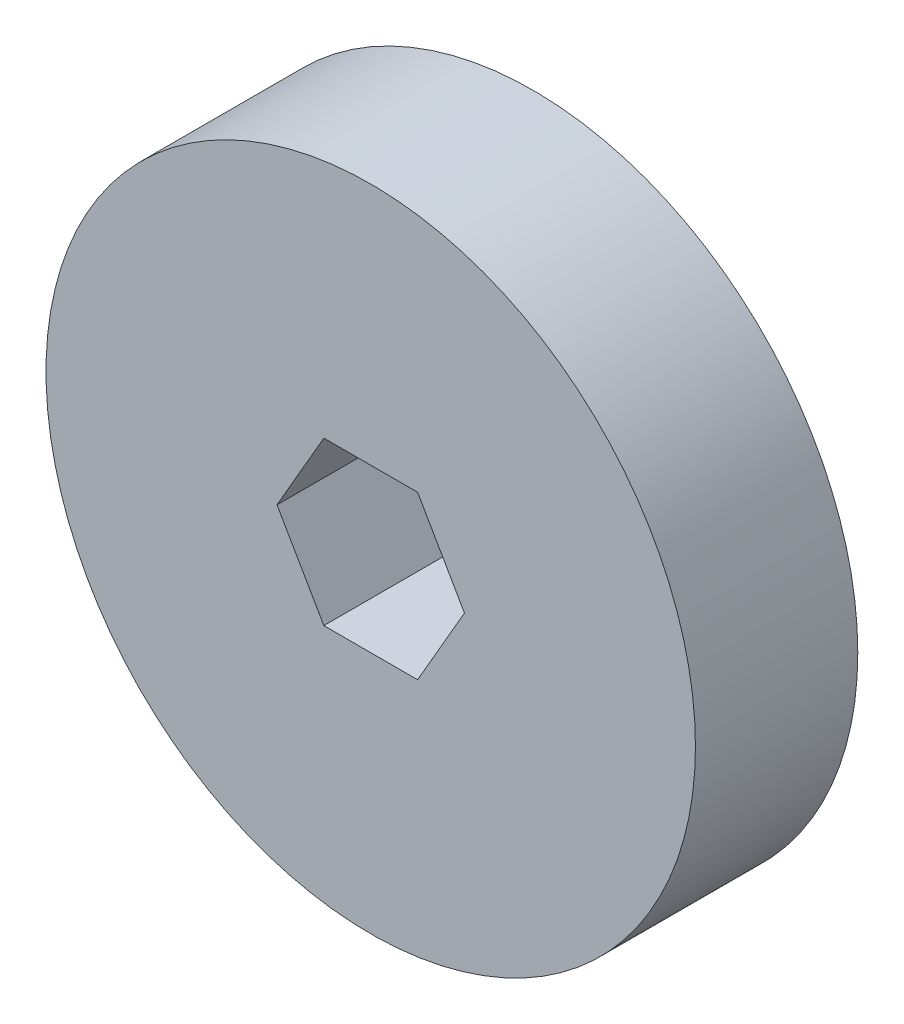
from build123d import *

# Parameters (mm, degrees)
SKETCH1_R               = 25.4
BOSS_EXTRUDE1_DEPTH     = 12.7
CUT_EXTRUDE1_DEPTH      = 39.1
CUT_EXTRUDE1_DEPTH_BACK = 39.1


with BuildPart() as part:
    # Sketch1 → Boss-Extrude1 (new body)
    with BuildSketch(Plane.XY):
        Circle(SKETCH1_R)
    extrude(amount=BOSS_EXTRUDE1_DEPTH)

    # Sketch2 → Cut-Extrude1 (cut, two sides: drawn at the far end of the back side and taken through both)
    with BuildSketch(Plane.XY.offset(12.7).offset(-CUT_EXTRUDE1_DEPTH_BACK)):
        Polygon((7.332348419, 0), (3.666174209, 6.35), (-3.666174209, 6.35), (-7.332348419, 0), (-3.666174209, -6.35), (3.666174209, -6.35), align=None)
    extrude(amount=CUT_EXTRUDE1_DEPTH + CUT_EXTRUDE1_DEPTH_BACK, mode=Mode.SUBTRACT)


solid = part.part
